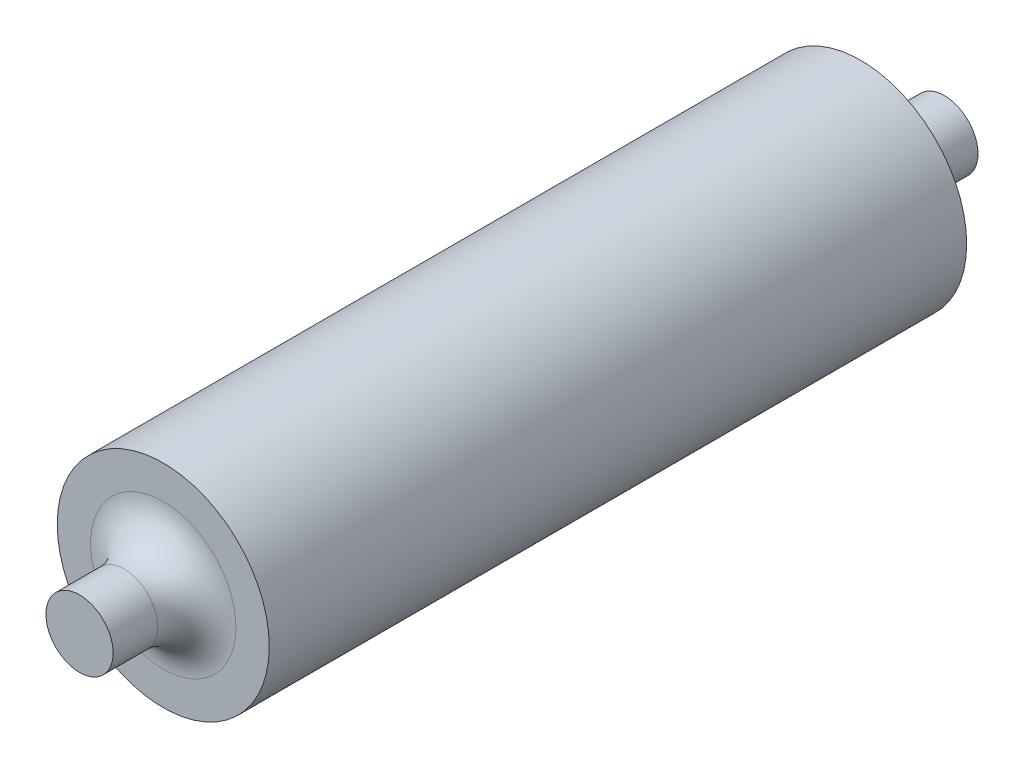
from build123d import *

# Parameters (mm, degrees)
SKETCH1_R                 = 19
SKETCH1_R_2               = 14
BOSS_EXTRUDE1_DEPTH       = 125
BOSS_EXTRUDE2_START       = 7.5
SKETCH2_R                 = 14
BOSS_EXTRUDE2_DEPTH       = 7.5
CUT_EXTRUDE1_DEPTH        = 121.53319045
CUT_EXTRUDE1_DEPTH_BACK   = 121.53319045
SKETCH4_R                 = 6.025
SKETCH5_R                 = 14
BOSS_EXTRUDE3_DEPTH       = 7.5
BOSS_EXTRUDE4_DEPTH       = 15
BOSS_EXTRUDE4_DEPTH_BACK  = 140
SKETCH7_R                 = 6.025
SKETCH8_R                 = 15
BOSS_EXTRUDE5_DEPTH       = 5
LPATTERN2_COUNT           = 2
LPATTERN2_PITCH           = 30
LPATTERN3_COPY_1_SKETCH_R = 15
LPATTERN3_COPY_1_DEPTH    = 5
LPATTERN3_COPY_2_SKETCH_R = 15
LPATTERN3_COPY_2_DEPTH    = 5
FILLET1_R                 = 7


with BuildPart() as part:
    # Sketch1 → Boss-Extrude1 (new body)
    with BuildSketch(Plane.XY):
        Circle(SKETCH1_R)
        Circle(SKETCH1_R_2, mode=Mode.SUBTRACT)
    extrude(amount=-BOSS_EXTRUDE1_DEPTH)

    # Sketch2 → Boss-Extrude2 (add)
    with BuildSketch(Plane.XY.offset(-7.5).offset(BOSS_EXTRUDE2_START)):
        Circle(SKETCH2_R)
    extrude(amount=-BOSS_EXTRUDE2_DEPTH)

    # Sketch4 → Cut-Extrude1 (cut, two sides: drawn at the far end of the back side and taken through both)
    with BuildSketch(Plane.XY.offset(-7.5).offset(-CUT_EXTRUDE1_DEPTH_BACK)):
        Circle(SKETCH4_R)
    extrude(amount=CUT_EXTRUDE1_DEPTH + CUT_EXTRUDE1_DEPTH_BACK, mode=Mode.SUBTRACT)

    # Sketch5 → Boss-Extrude3 (add)
    with BuildSketch(Plane(origin=(0, 0, -117.5), x_dir=(-1, 0, 0), z_dir=(0, 0, -1))):
        with Locations(Location((0, 0, 0), (0, 0, 180))):
            Circle(SKETCH5_R)
    extrude(amount=BOSS_EXTRUDE3_DEPTH)

    # Sketch7 → Boss-Extrude4 (add, two sides: drawn at the far end of the back side and taken through both)
    with BuildSketch(Plane.XY.offset(-BOSS_EXTRUDE4_DEPTH_BACK)):
        Circle(SKETCH7_R)
    extrude(amount=BOSS_EXTRUDE4_DEPTH + BOSS_EXTRUDE4_DEPTH_BACK)

    # Sketch8 → Boss-Extrude5 (add, symmetric)
    with BuildSketch(Plane.XY.offset(-62.5)):
        Circle(SKETCH8_R)
    boss_extrude5 = extrude(amount=BOSS_EXTRUDE5_DEPTH, both=True)

    # LPattern2: Boss-Extrude5 ×2
    with Locations(*[(0, 0, -i * LPATTERN2_PITCH) for i in range(1, LPATTERN2_COUNT)]):
        add(boss_extrude5)

    # LPattern3 copy 1 sketch → LPattern3 copy 1 (add, symmetric)
    with BuildSketch(Plane.XY.offset(-62.5)):
        Circle(LPATTERN3_COPY_1_SKETCH_R)
    extrude(amount=LPATTERN3_COPY_1_DEPTH, both=True)

    # LPattern3 copy 2 sketch → LPattern3 copy 2 (add, symmetric)
    with BuildSketch(Plane.XY.offset(-32.5)):
        Circle(LPATTERN3_COPY_2_SKETCH_R)
    extrude(amount=LPATTERN3_COPY_2_DEPTH, both=True)

    # Fillet1
    fillet1_edges = [part.edges().sort_by_distance(p)[0] for p in [
        (-6.025, 0, 0),
        (-6.025, 0, -125),
    ]]
    fillet(fillet1_edges, radius=FILLET1_R)


solid = part.part
